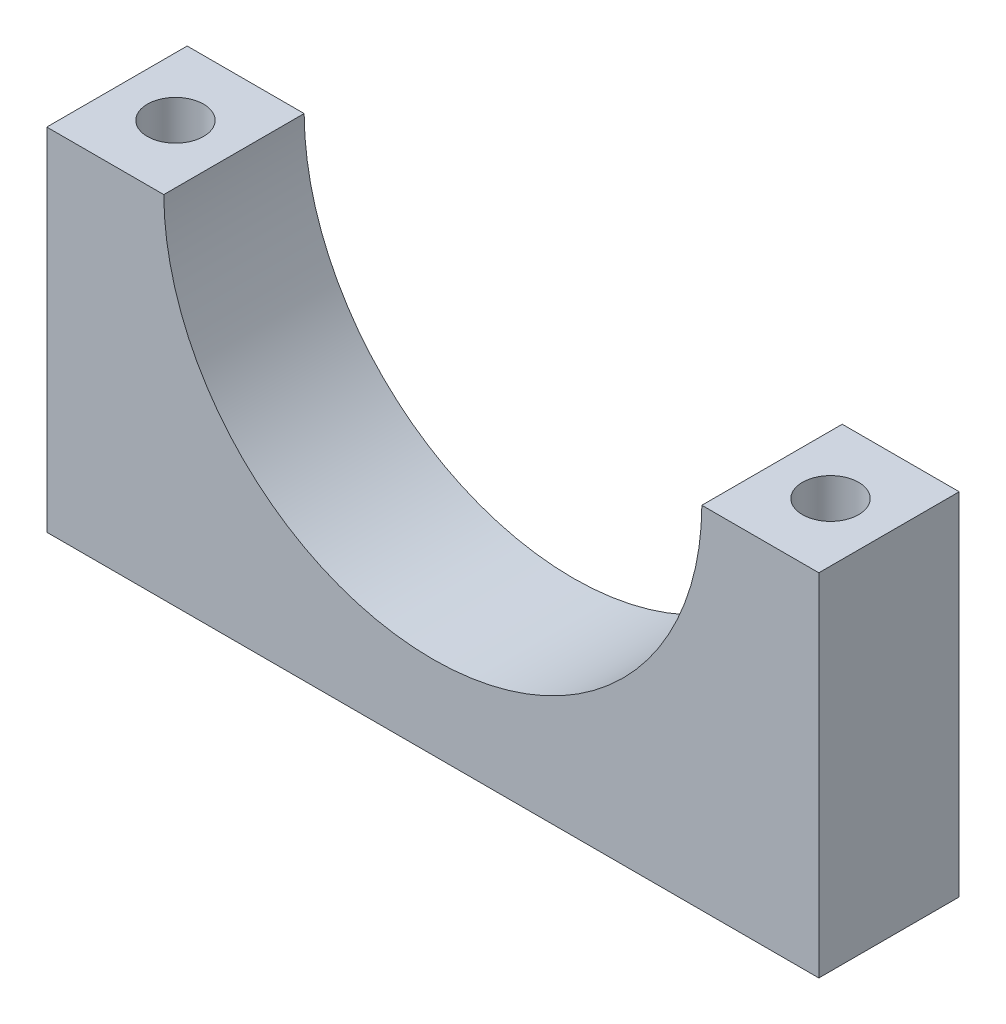
from build123d import *

# Parameters (mm, degrees)
SKETCH_1_W                   = 66
SKETCH_1_H                   = 30
EXTRUDE_1_DEPTH              = 12
SKETCH_2_R                   = 23
CUT_EXTRUDE_1_DEPTH          = 74.484692283
HOLE_WIZARD_M4_1_D           = 4.8
HOLE_WIZARD_M4_1_CBORE_D     = 8
HOLE_WIZARD_M4_1_CBORE_DEPTH = 4


with BuildPart() as part:
    # 草图1 → 凸台-拉伸1 (new body)
    with BuildSketch(Plane.XY):
        with Locations((33, 15)):
            Rectangle(SKETCH_1_W, SKETCH_1_H)
    extrude(amount=EXTRUDE_1_DEPTH)

    # 草图2 → 切除-拉伸1 (cut, through all)
    with BuildSketch(Plane.XY.offset(12)):
        with Locations((33, 30.1)):
            Circle(SKETCH_2_R)
    extrude(amount=-CUT_EXTRUDE_1_DEPTH, mode=Mode.SUBTRACT)

    # M4 六角凹头螺钉的柱形沉头孔1 (through all)
    with Locations(Plane.XZ):
        with Locations((61, 6), (5, 6)):
            CounterBoreHole(HOLE_WIZARD_M4_1_D / 2, HOLE_WIZARD_M4_1_CBORE_D / 2, HOLE_WIZARD_M4_1_CBORE_DEPTH)


solid = part.part
